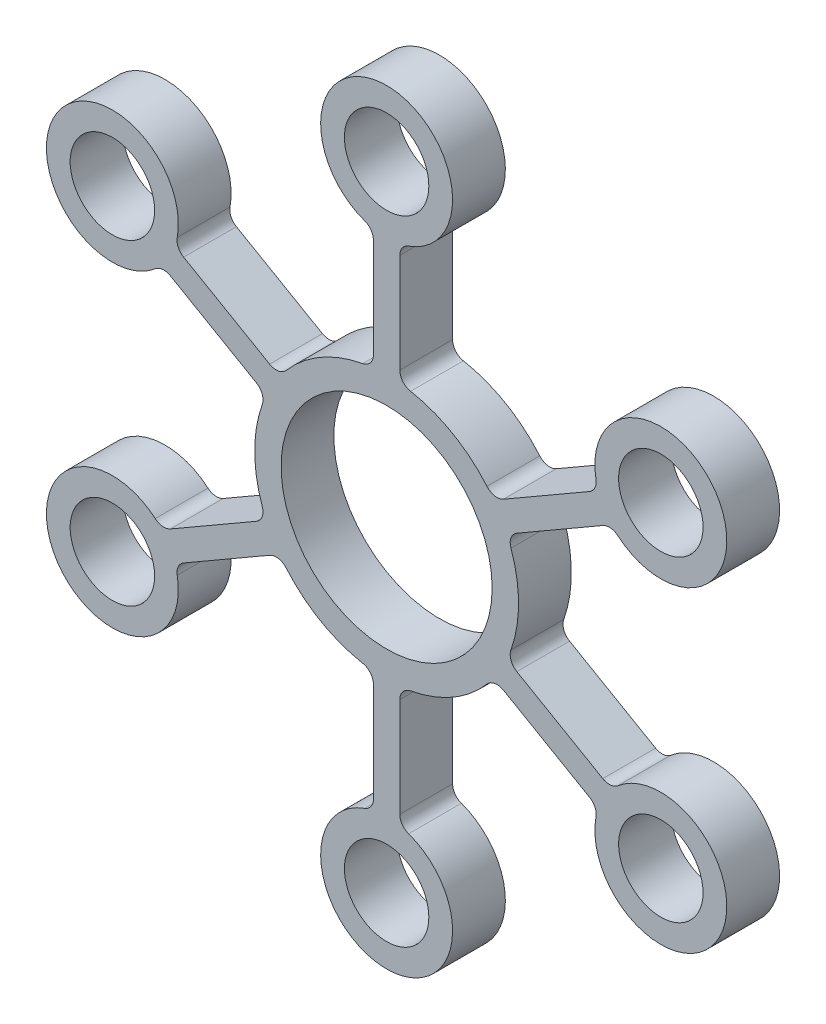
from build123d import *

# Parameters (mm, degrees)
SKETCH_1_R      = 1.6
SKETCH_1_R_2    = 4
EXTRUDE_1_DEPTH = 2
FILLET_1_R      = 0.5


with BuildPart() as part:
    # ｽｹｯﾁ1 → ﾎﾞｽ - 押し出し1 (new body)
    with BuildSketch(Plane.XY):
        with BuildLine():
            Line((4.058421985, 2.920481295), (8.020984502, 5.208267831))
            ThreePointArc((8.020984502, 5.208267831), (12.557368355, 7.25), (8.520984502, 4.342242427))
            Line((8.520984502, 4.342242427), (4.558421985, 2.054455891))
            ThreePointArc((4.558421985, 2.054455891), (5, 0), (4.558421985, -2.054455891))
            Line((4.558421985, -2.054455891), (8.520984502, -4.342242427))
            ThreePointArc((8.520984502, -4.342242427), (12.557368355, -7.25), (8.020984502, -5.208267831))
            Line((8.020984502, -5.208267831), (4.058421985, -2.920481295))
            ThreePointArc((4.058421985, -2.920481295), (2.5, -4.330127019), (0.5, -4.974937186))
            Line((0.5, -4.974937186), (0.5, -9.550510257))
            ThreePointArc((0.5, -9.550510257), (0, -14.5), (-0.5, -9.550510257))
            Line((-0.5, -9.550510257), (-0.5, -4.974937186))
            ThreePointArc((-0.5, -4.974937186), (-2.5, -4.330127019), (-4.058421985, -2.920481295))
            Line((-4.058421985, -2.920481295), (-8.020984502, -5.208267831))
            ThreePointArc((-8.020984502, -5.208267831), (-12.557368355, -7.25), (-8.520984502, -4.342242427))
            Line((-8.520984502, -4.342242427), (-4.558421985, -2.054455891))
            ThreePointArc((-4.558421985, -2.054455891), (-5, 0), (-4.558421985, 2.054455891))
            Line((-4.558421985, 2.054455891), (-8.520984502, 4.342242427))
            ThreePointArc((-8.520984502, 4.342242427), (-12.557368355, 7.25), (-8.020984502, 5.208267831))
            Line((-8.020984502, 5.208267831), (-4.058421985, 2.920481295))
            ThreePointArc((-4.058421985, 2.920481295), (-2.5, 4.330127019), (-0.5, 4.974937186))
            Line((-0.5, 4.974937186), (-0.5, 9.550510257))
            ThreePointArc((-0.5, 9.550510257), (0, 14.5), (0.5, 9.550510257))
            Line((0.5, 9.550510257), (0.5, 4.974937186))
            ThreePointArc((0.5, 4.974937186), (2.5, 4.330127019), (4.058421985, 2.920481295))
        make_face()
        with Locations((0, 12)):
            Circle(SKETCH_1_R, mode=Mode.SUBTRACT)
        with Locations((10.392304845, 6)):
            Circle(SKETCH_1_R, mode=Mode.SUBTRACT)
        with Locations((10.392304845, -6)):
            Circle(SKETCH_1_R, mode=Mode.SUBTRACT)
        with Locations((0, -12)):
            Circle(SKETCH_1_R, mode=Mode.SUBTRACT)
        with Locations((-10.392304845, -6)):
            Circle(SKETCH_1_R, mode=Mode.SUBTRACT)
        with Locations((-10.392304845, 6)):
            Circle(SKETCH_1_R, mode=Mode.SUBTRACT)
        Circle(SKETCH_1_R_2, mode=Mode.SUBTRACT)
    extrude(amount=EXTRUDE_1_DEPTH)

    # ﾌｨﾚｯﾄ1
    fillet_1_edges = [part.edges().sort_by_distance(p)[0] for p in [
        (0.5, 9.550510257, 1),
        (0.5, 4.974937186, 1),
        (4.058421985, 2.920481295, 1),
        (8.020984502, 5.208267831, 1),
        (8.520984502, 4.342242427, 1),
        (4.558421985, 2.054455891, 1),
        (4.558421985, -2.054455891, 1),
        (8.520984502, -4.342242427, 1),
        (8.020984502, -5.208267831, 1),
        (4.058421985, -2.920481295, 1),
        (0.5, -4.974937186, 1),
        (0.5, -9.550510257, 1),
        (-0.5, -9.550510257, 1),
        (-0.5, -4.974937186, 1),
        (-4.058421985, -2.920481295, 1),
        (-8.020984502, -5.208267831, 1),
        (-8.520984502, -4.342242427, 1),
        (-4.558421985, -2.054455891, 1),
        (-4.558421985, 2.054455891, 1),
        (-8.520984502, 4.342242427, 1),
        (-8.020984502, 5.208267831, 1),
        (-4.058421985, 2.920481295, 1),
        (-0.5, 4.974937186, 1),
        (-0.5, 9.550510257, 1),
    ]]
    fillet(fillet_1_edges, radius=FILLET_1_R)


solid = part.part
